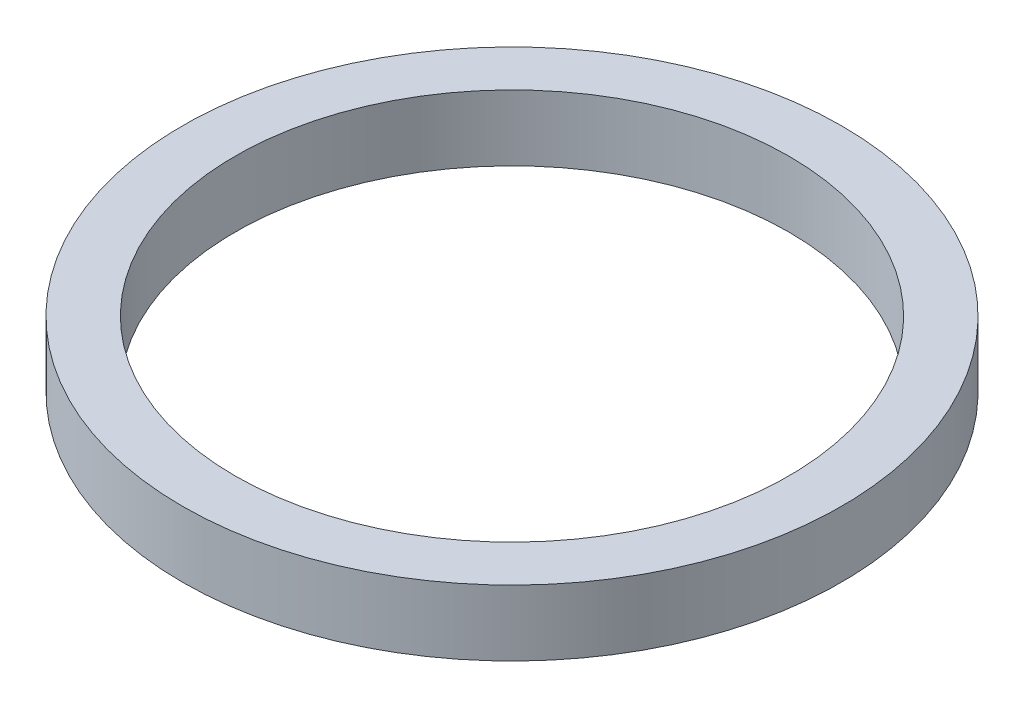
from build123d import *

# Parameters (mm, degrees)
CROQUIS1_R              = 25.05
CROQUIS1_R_2            = 21.05
SALIENTE_EXTRUIR1_DEPTH = 5


with BuildPart() as part:
    # Croquis1 → Saliente-Extruir1 (new body)
    with BuildSketch(Plane(origin=(0, 0, 0), x_dir=(1, 0, 0), z_dir=(0, 1, 0))):
        with Locations(Location((0, 0, 0), (0, 0, 270))):
            Circle(CROQUIS1_R)
        with Locations(Location((0, 0, 0), (0, 0, 270))):
            Circle(CROQUIS1_R_2, mode=Mode.SUBTRACT)
    extrude(amount=SALIENTE_EXTRUIR1_DEPTH)


solid = part.part
